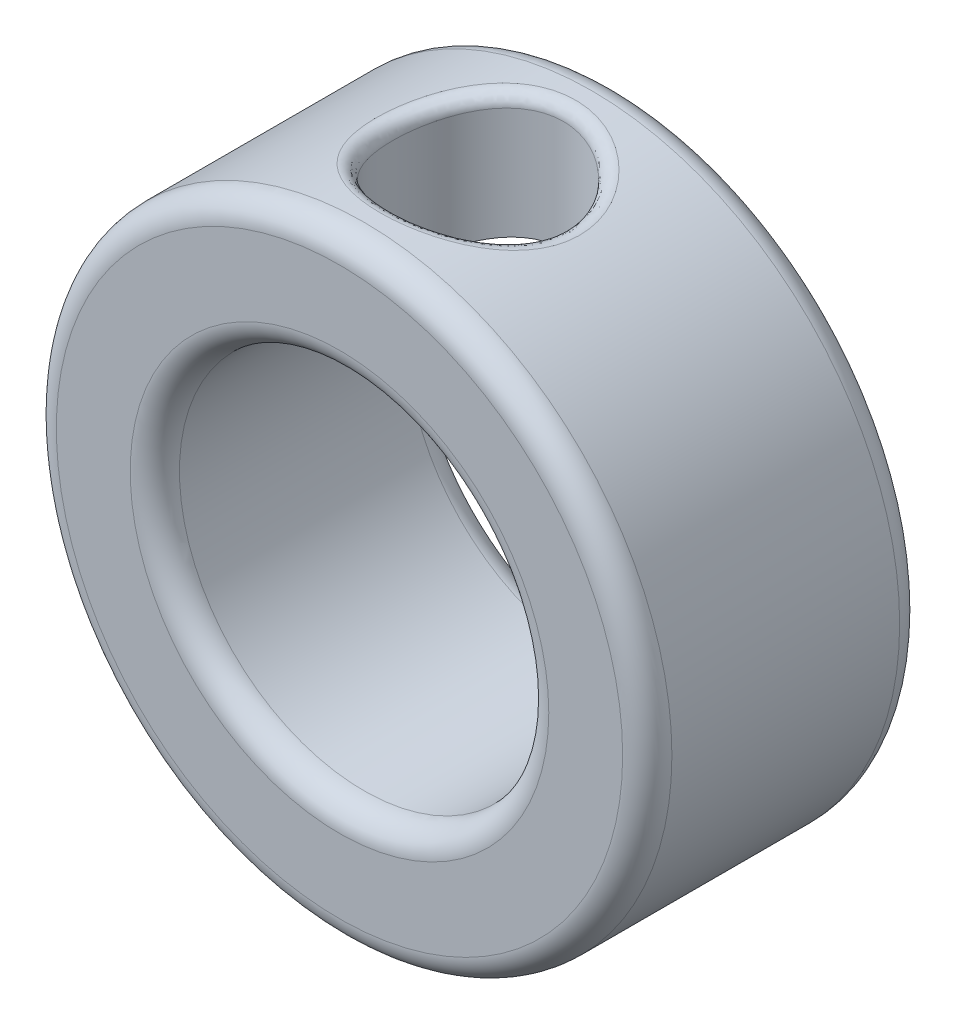
from build123d import *

# Parameters (mm, degrees)
BOSS_EXTRUDE1_DEPTH      = 7.14375
BOSS_EXTRUDE1_DEPTH_BACK = 7.14375
SKETCH1_R                = 15.875
SKETCH1_R_2              = 9.525
FILLET1_R                = 1.27
SKETCH3_R                = 4.402753613
CUT_EXTRUDE1_DEPTH       = 24.559805119
FILLET2_R                = 0.635


with BuildPart() as part:
    # Sketch1 → Boss-Extrude1 (new, two sides: drawn at the far end of the back side and taken through both)
    with BuildSketch(Plane.XY.offset(-BOSS_EXTRUDE1_DEPTH_BACK)):
        Circle(SKETCH1_R)
        Circle(SKETCH1_R_2, mode=Mode.SUBTRACT)
    extrude(amount=BOSS_EXTRUDE1_DEPTH + BOSS_EXTRUDE1_DEPTH_BACK)

    # Fillet1
    fillet1_edges = [part.edges().sort_by_distance(p)[0] for p in [
        (-15.875, 0, -7.14375),
        (-9.525, 0, -7.14375),
        (-15.875, 0, 7.14375),
        (-9.525, 0, 7.14375),
    ]]
    fillet(fillet1_edges, radius=FILLET1_R)

    # Sketch3 → Cut-Extrude1 (cut, through all)
    with BuildSketch(Plane(origin=(0, 0, 0), x_dir=(1, 0, 0), z_dir=(0, 1, 0))):
        Circle(SKETCH3_R)
    extrude(amount=CUT_EXTRUDE1_DEPTH, mode=Mode.SUBTRACT)

    # Fillet2
    fillet2_edges = [part.edges().sort_by_distance(p)[0] for p in [
        (0, 15.875, 4.402753613),
    ]]
    fillet(fillet2_edges, radius=FILLET2_R)


solid = part.part
